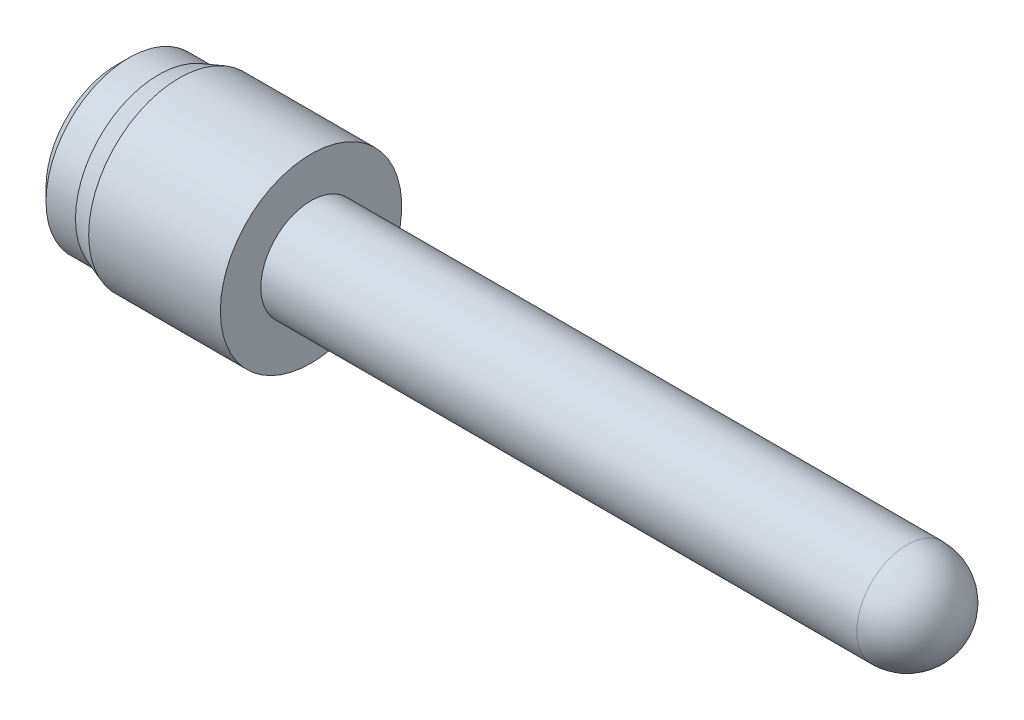
from build123d import *


with BuildPart() as part:
    # Sketch1 → RevolutionAngle1 (revolve)
    with BuildSketch(Plane.XY, mode=Mode.PRIVATE) as revolutionangle1_sk:
        with BuildLine():
            Line((0, 0), (0, 0.28575))
            Line((0, 0.28575), (0.0508, 0.33655))
            Line((0.0508, 0.33655), (0.170256888, 0.33655))
            Line((0.170256888, 0.33655), (0.254, 0.36703))
            Line((0.254, 0.36703), (0.7874, 0.36703))
            Line((0.7874, 0.36703), (0.7874, 0.2032))
            Line((0.7874, 0.2032), (3.2004, 0.2032))
            ThreePointArc((3.2004, 0.2032), (3.344084098, 0.143684098), (3.4036, 0))
            Line((3.4036, 0), (0, 0))
        make_face()
    revolve(revolutionangle1_sk.sketch.rotate(Axis((0, 0, 0), (1, 0, 0)), 90), axis=Axis((0, 0, 0), (1, 0, 0)))


solid = part.part
